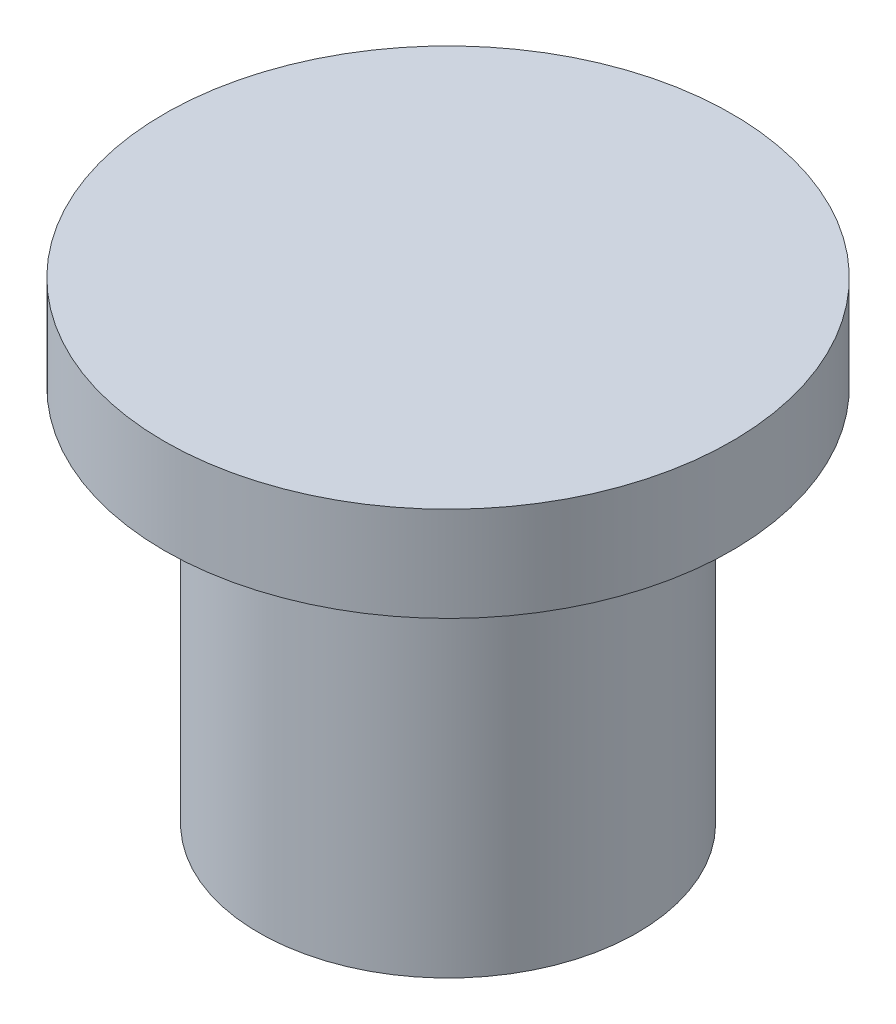
from build123d import *

# Parameters (mm, degrees)
SKETCH1_R           = 7.5
BOSS_EXTRUDE1_DEPTH = 2.5
SKETCH2_R           = 5
BOSS_EXTRUDE2_DEPTH = 10


with BuildPart() as part:
    # Sketch1 → Boss-Extrude1 (new body)
    with BuildSketch(Plane(origin=(0, 0, 0), x_dir=(1, 0, 0), z_dir=(0, 1, 0))):
        with Locations(Location((0, 0, 0), (0, 0, 270))):
            Circle(SKETCH1_R)
    extrude(amount=BOSS_EXTRUDE1_DEPTH)

    # Sketch2 → Boss-Extrude2 (add)
    with BuildSketch(Plane.XZ):
        with Locations(Location((0, 0, 0), (0, 0, 270))):
            Circle(SKETCH2_R)
    extrude(amount=BOSS_EXTRUDE2_DEPTH)


solid = part.part
